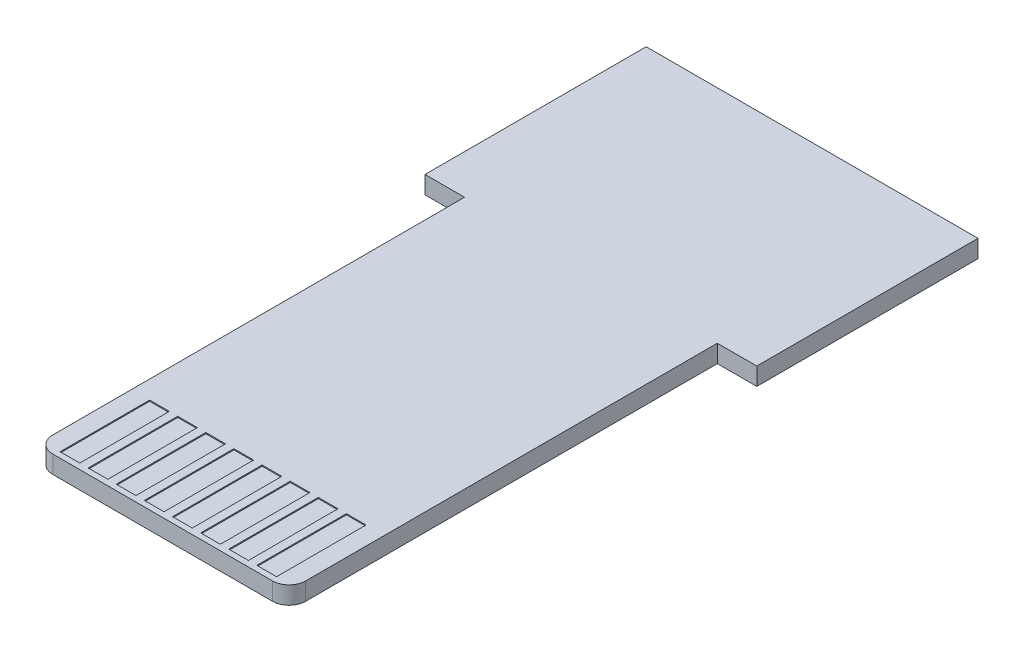
from build123d import *

# Parameters (mm, degrees)
EXTRUDE_1_DEPTH     = 1.6
CUT_EXTRUDE_START   = 1.6
SKETCH_3_W          = 1.78
SKETCH_3_H          = 8.1
CUT_EXTRUDE_1_DEPTH = 0.1
SKETCH_4_W          = 1.78
SKETCH_4_H          = 8.1
CUT_EXTRUDE_2_DEPTH = 0.1


with BuildPart() as part:
    # 草图1 → 凸台-拉伸1 (new body)
    with BuildSketch(Plane(origin=(0, 0, 0), x_dir=(1, 0, 0), z_dir=(0, 1, 0))):
        with BuildLine():
            Line((11.43, -10), (15, -10))
            Line((15, -10), (15, 10))
            Line((15, 10), (-15, 10))
            Line((-15, 10), (-15, -10))
            Line((-15, -10), (-11.43, -10))
            Line((-11.43, -10), (-11.43, -47.22))
            ThreePointArc((-11.43, -47.22), (-10.990660172, -48.280660172), (-9.93, -48.72))
            Line((-9.93, -48.72), (9.93, -48.72))
            ThreePointArc((9.93, -48.72), (10.990660172, -48.280660172), (11.43, -47.22))
            Line((11.43, -47.22), (11.43, -10))
        make_face()
    extrude(amount=EXTRUDE_1_DEPTH)

    # 草图3 → 切除-拉伸1 (cut)
    with BuildSketch(Plane(origin=(0, 0, 0), x_dir=(1, 0, 0), z_dir=(0, 1, 0)).offset(CUT_EXTRUDE_START)):
        with Locations((-1.275, -44.16)):
            Rectangle(SKETCH_3_W, SKETCH_3_H)
        with Locations((1.275, -44.16)):
            Rectangle(SKETCH_3_W, SKETCH_3_H)
        with Locations((-3.815, -44.16)):
            Rectangle(SKETCH_3_W, SKETCH_3_H)
        with Locations((-6.355, -44.16)):
            Rectangle(SKETCH_3_W, SKETCH_3_H)
        with Locations((-8.895, -44.16)):
            Rectangle(SKETCH_3_W, SKETCH_3_H)
        with Locations((3.815, -44.16)):
            Rectangle(SKETCH_3_W, SKETCH_3_H)
        with Locations((6.355, -44.16)):
            Rectangle(SKETCH_3_W, SKETCH_3_H)
        with Locations((8.895, -44.16)):
            Rectangle(SKETCH_3_W, SKETCH_3_H)
    extrude(amount=-CUT_EXTRUDE_1_DEPTH, mode=Mode.SUBTRACT)

    # 草图4 → 切除-拉伸2 (cut)
    with BuildSketch(Plane(origin=(0, 0, 0), x_dir=(1, 0, 0), z_dir=(0, 1, 0))):
        with Locations((1.275, -44.16)):
            Rectangle(SKETCH_4_W, SKETCH_4_H)
        with Locations((-1.275, -44.16)):
            Rectangle(SKETCH_4_W, SKETCH_4_H)
        with Locations((-8.895, -44.16)):
            Rectangle(SKETCH_4_W, SKETCH_4_H)
        with Locations((-6.355, -44.16)):
            Rectangle(SKETCH_4_W, SKETCH_4_H)
        with Locations((-3.815, -44.16)):
            Rectangle(SKETCH_4_W, SKETCH_4_H)
        with Locations((8.895, -44.16)):
            Rectangle(SKETCH_4_W, SKETCH_4_H)
        with Locations((6.355, -44.16)):
            Rectangle(SKETCH_4_W, SKETCH_4_H)
        with Locations((3.815, -44.16)):
            Rectangle(SKETCH_4_W, SKETCH_4_H)
    extrude(amount=CUT_EXTRUDE_2_DEPTH, mode=Mode.SUBTRACT)


solid = part.part
